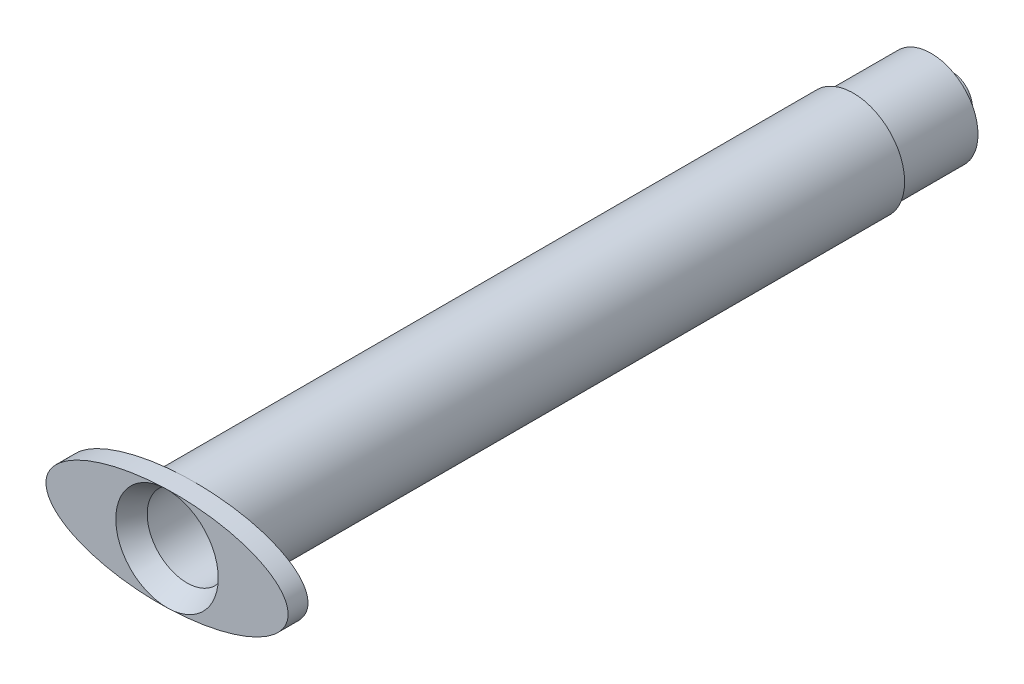
from build123d import *

# Parameters (mm, degrees)
SKETCH1_R           = 5.17
SKETCH1_R_2         = 4.1
BOSS_EXTRUDE1_DEPTH = 67.25
SKETCH2_RX          = 12.22
SKETCH2_RY          = 5.17
BOSS_EXTRUDE2_DEPTH = 2.01
SKETCH3_R           = 5.17
CUT_EXTRUDE1_DEPTH  = 2.01
CUT_EXTRUDE1_DRAFT  = -30
SKETCH4_R           = 2.06
SKETCH4_R_2         = 0.795
BOSS_EXTRUDE3_DEPTH = 9.95
SKETCH5_R           = 4.0952596
BOSS_EXTRUDE4_DEPTH = 1.15
SKETCH7_R           = 0.795
CUT_EXTRUDE2_DEPTH  = 81.313643922
SKETCH9_R           = 4.725
SKETCH9_R_2         = 4.11
BOSS_EXTRUDE6_DEPTH = 7.85


with BuildPart() as part:
    # Sketch1 → Boss-Extrude1 (new body)
    with BuildSketch(Plane.XY):
        Circle(SKETCH1_R)
        Circle(SKETCH1_R_2, mode=Mode.SUBTRACT)
    extrude(amount=BOSS_EXTRUDE1_DEPTH)

    # Sketch2 → Boss-Extrude2 (add)
    with BuildSketch(Plane.XY.offset(67.25)):
        with Locations(Location((0, 0), (0, 0, -177.979667621))):
            Ellipse(SKETCH2_RX, SKETCH2_RY)
    extrude(amount=BOSS_EXTRUDE2_DEPTH)


with BuildPart() as cut_extrude1_tool:
    # Sketch3 → Cut-Extrude1 (with draft: the straight prism first)
    with BuildSketch(Plane.XY.offset(69.26)):
        with Locations(Location((0, 0, 0), (0, 0, 92.020332379))):
            Circle(SKETCH3_R)
    extrude(amount=-CUT_EXTRUDE1_DEPTH)
    # Cut-Extrude1: the draft: its side faces are tilted about the plane it starts from
    cut_extrude1_sides = [cut_extrude1_tool.faces().sort_by_distance(p)[0] for p in [
        (0.182263931, -5.166786222, 68.255),
    ]]
    draft(cut_extrude1_sides, Plane.XY.offset(69.26), CUT_EXTRUDE1_DRAFT)


with BuildPart() as part_1:
    add(part.part)

    # Cut-Extrude1: cut by cut_extrude1_tool
    add(cut_extrude1_tool.part, mode=Mode.SUBTRACT)

    # Sketch9 → Boss-Extrude6 (add)
    with BuildSketch(Plane(origin=(0, 0, 0), x_dir=(-1, 0, 0), z_dir=(0, 0, -1))):
        with Locations(Location((0, 0, 0), (0, 0, 180))):
            Circle(SKETCH9_R)
        Circle(SKETCH9_R_2, mode=Mode.SUBTRACT)
    extrude(amount=BOSS_EXTRUDE6_DEPTH)


with BuildPart() as body_2:
    # Sketch4 → Boss-Extrude3 (new body)
    with BuildSketch(Plane(origin=(0, 0, 0), x_dir=(-1, 0, 0), z_dir=(0, 0, -1))):
        with Locations(Location((0, 0, 0), (0, 0, 180))):
            Circle(SKETCH4_R)
        with Locations(Location((0, 0, 0), (0, 0, 180))):
            Circle(SKETCH4_R_2, mode=Mode.SUBTRACT)
    extrude(amount=BOSS_EXTRUDE3_DEPTH)

    # Sketch5 → Boss-Extrude4 (add)
    with BuildSketch(Plane(origin=(0, 0, 0), x_dir=(-1, 0, 0), z_dir=(0, 0, -1))):
        Circle(SKETCH5_R)
    extrude(amount=BOSS_EXTRUDE4_DEPTH)

    # Sketch7 → Cut-Extrude2 (cut, through all)
    with BuildSketch(Plane(origin=(0, 0, -9.95), x_dir=(-1, 0, 0), z_dir=(0, 0, -1))):
        with Locations(Location((0, 0, 0), (0, 0, 180))):
            Circle(SKETCH7_R)
    extrude(amount=-CUT_EXTRUDE2_DEPTH, mode=Mode.SUBTRACT)


solid = Compound([part_1.part, body_2.part])
